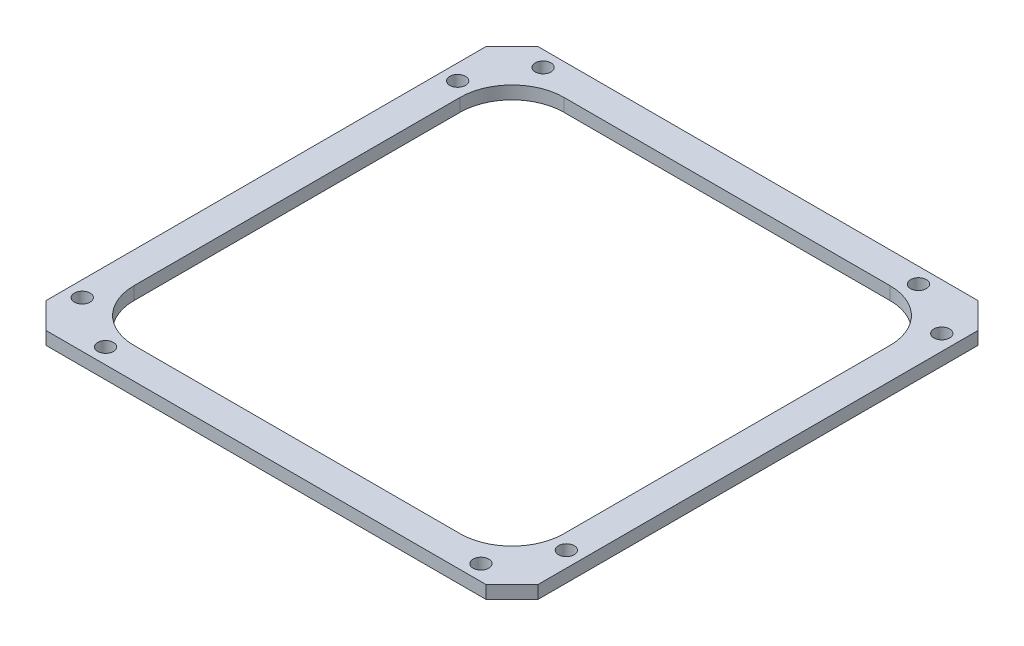
from build123d import *

# Parameters (mm, degrees)
SKETCH1_W           = 190
SKETCH1_H           = 190
BOSS_EXTRUDE1_DEPTH = 5
SKETCH2_W           = 166
SKETCH2_H           = 166
CUT_EXTRUDE1_DEPTH  = 135.443296597
FILLET1_R           = 20
SKETCH3_R           = 3.05
CUT_EXTRUDE2_DEPTH  = 135.443296597
CHAMFER1_SIZE       = 10


with BuildPart() as part:
    # Sketch1 → Boss-Extrude1 (new body)
    with BuildSketch(Plane(origin=(0, 0, 0), x_dir=(1, 0, 0), z_dir=(0, 1, 0))):
        Rectangle(SKETCH1_W, SKETCH1_H)
    extrude(amount=BOSS_EXTRUDE1_DEPTH)

    # Sketch2 → Cut-Extrude1 (cut, through all)
    with BuildSketch(Plane(origin=(0, 5, 0), x_dir=(1, 0, 0), z_dir=(0, 1, 0))):
        Rectangle(SKETCH2_W, SKETCH2_H)
    extrude(amount=-CUT_EXTRUDE1_DEPTH, mode=Mode.SUBTRACT)

    # Fillet1
    fillet1_edges = [part.edges().sort_by_distance(p)[0] for p in [
        (83, 2.5, -83),
        (83, 2.5, 83),
        (-83, 2.5, 83),
        (-83, 2.5, -83),
    ]]
    fillet(fillet1_edges, radius=FILLET1_R)

    # Sketch3 → Cut-Extrude2 (cut, through all)
    with BuildSketch(Plane(origin=(0, 5, 0), x_dir=(1, 0, 0), z_dir=(0, 1, 0))):
        with Locations(Location((-77, 89, 0), (0, 0, 270))):
            Circle(SKETCH3_R)
        with Locations(Location((-89, 68, 0), (0, 0, 270))):
            Circle(SKETCH3_R)
        with Locations(Location((89, 77, 0), (0, 0, 270))):
            Circle(SKETCH3_R)
        with Locations(Location((68, 89, 0), (0, 0, 270))):
            Circle(SKETCH3_R)
        with Locations(Location((77, -89, 0), (0, 0, 270))):
            Circle(SKETCH3_R)
        with Locations(Location((89, -68, 0), (0, 0, 270))):
            Circle(SKETCH3_R)
        with Locations(Location((-89, -77, 0), (0, 0, 270))):
            Circle(SKETCH3_R)
        with Locations(Location((-68, -89, 0), (0, 0, 270))):
            Circle(SKETCH3_R)
    extrude(amount=-CUT_EXTRUDE2_DEPTH, mode=Mode.SUBTRACT)

    # Chamfer1
    chamfer1_edges = [part.edges().sort_by_distance(p)[0] for p in [
        (-95, 2.5, -95),
        (-95, 2.5, 95),
        (95, 2.5, 95),
        (95, 2.5, -95),
    ]]
    chamfer(chamfer1_edges, length=CHAMFER1_SIZE)


solid = part.part
